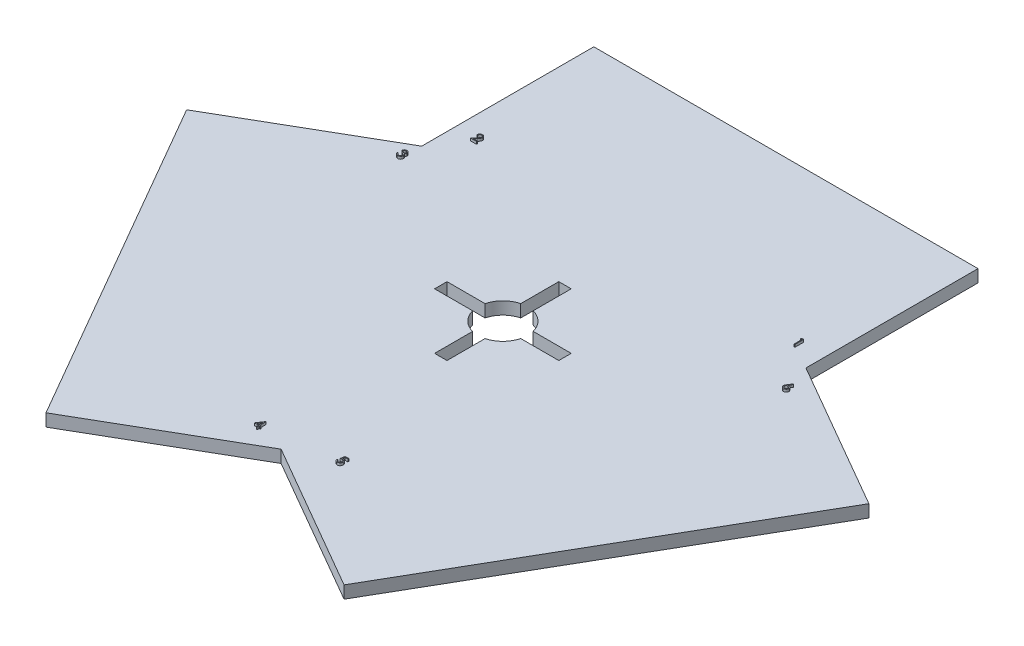
from build123d import *

# Parameters (mm, degrees)
BOSS_EXTRUDE1_DEPTH = 5
BOSS_EXTRUDE2_DEPTH = 1


with BuildPart() as part:
    # Sketch1 → Boss-Extrude1 (new body)
    with BuildSketch(Plane(origin=(0, 0, 0), x_dir=(1, 0, 0), z_dir=(0, 1, 0))):
        Polygon((-77.327282718, 44.644927493), (-77.327282718, 113.91847338), (77.327282718, 113.91847338), (77.327282718, 44.644927493), (137.319933266, 10.008154549), (59.992650548, -123.926627929), (0, -89.289854985), (-59.992650548, -123.926627929), (-137.319933266, 10.008154549), align=None)
        with BuildLine():
            ThreePointArc((9.682458366, 2.5), (7.071067812, 7.071067812), (2.5, 9.682458366))
            Line((2.5, 9.682458366), (2.5, 25))
            Line((2.5, 25), (-2.5, 25))
            Line((-2.5, 25), (-2.5, 9.682458366))
            ThreePointArc((-2.5, 9.682458366), (-7.071067812, 7.071067812), (-9.682458366, 2.5))
            Line((-9.682458366, 2.5), (-25, 2.5))
            Line((-25, 2.5), (-25, -2.5))
            Line((-25, -2.5), (-9.682458366, -2.5))
            ThreePointArc((-9.682458366, -2.5), (-7.071067812, -7.071067812), (-2.5, -9.682458366))
            Line((-2.5, -9.682458366), (-2.5, -25))
            Line((-2.5, -25), (2.5, -25))
            Line((2.5, -25), (2.5, -9.682458366))
            ThreePointArc((2.5, -9.682458366), (7.071067812, -7.071067812), (9.682458366, -2.5))
            Line((9.682458366, -2.5), (25, -2.5))
            Line((25, -2.5), (25, 2.5))
            Line((25, 2.5), (9.682458366, 2.5))
        make_face(mode=Mode.SUBTRACT)
    extrude(amount=BOSS_EXTRUDE1_DEPTH)

    # Sketch2 → Boss-Extrude2 (add)
    # profile 1 of 6: a face of its own
    with BuildSketch(Plane(origin=(0, 5, 0), x_dir=(1, 0, 0), z_dir=(0, 1, 0))):
        Polygon((67.265718779, 53.176435359), (67.912854195, 53.176435359), (67.912854195, 49.676435359), (67.598751631, 49.676435359), (67.598751631, 52.817461), (67.060290093, 52.817461), align=None)
    # profile 2 of 6: a face of its own
    with BuildSketch(Plane(origin=(0, 5, 0), x_dir=(1, 0, 0), z_dir=(0, 1, 0))):
        with BuildLine():
            Line((-68.907626042, 58.727715821), (-69.221728606, 58.727715821))
            add(Edge.make_bspline(
                [(-69.221728606, 58.727715821), (-69.219681453, 58.769386709), (-69.215660899, 58.851227223), (-69.19683261, 58.97055113), (-69.169891733, 59.084605928), (-69.131800279, 59.192475842), (-69.084494001, 59.29511465), (-69.027763974, 59.392114665), (-68.960570123, 59.483105854), (-68.884363389, 59.567244697), (-68.80159475, 59.644432268), (-68.712288811, 59.711087511), (-68.618443783, 59.767405182), (-68.520344384, 59.814486424), (-68.416883821, 59.84982627), (-68.309000963, 59.87604791), (-68.196221826, 59.891824255), (-68.119381804, 59.893520041), (-68.080302324, 59.894382488)],
                knots=[0, 0, 0, 0, 1.10065271, 2.161652631, 3.183658789, 4.190468796, 5.17591951, 6.163126047, 7.15150782, 8.156236427, 9.156009102, 10.134482811, 11.092018607, 12.041330605, 13.001268258, 13.972401359, 14.968799086, 16, 16, 16, 16], degree=3))
            add(Edge.make_bspline(
                [(-68.080302324, 59.894382488), (-68.04192425, 59.893484031), (-67.966512705, 59.891718596), (-67.856450691, 59.876557567), (-67.751673397, 59.852811975), (-67.65238563, 59.819496559), (-67.559379565, 59.774712132), (-67.471956521, 59.720914593), (-67.38907571, 59.658694762), (-67.314468926, 59.585440948), (-67.245960847, 59.507238564), (-67.186858592, 59.42375066), (-67.136245429, 59.337521374), (-67.094057749, 59.247893173), (-67.06300161, 59.154022144), (-67.039423402, 59.057274942), (-67.026095988, 58.956650131), (-67.024050565, 58.888543575), (-67.023010658, 58.853917744)],
                knots=[0, 0, 0, 0, 1.111607364, 2.184268762, 3.212621178, 4.221274766, 5.211760367, 6.196651075, 7.1921475, 8.207485113, 9.220403448, 10.201281604, 11.166441695, 12.114753415, 13.065576456, 14.026450734, 14.996634279, 16, 16, 16, 16], degree=3))
            add(Edge.make_bspline(
                [(-67.023010658, 58.853917744), (-67.02470392, 58.805169909), (-67.028060732, 58.708529696), (-67.056775108, 58.566514833), (-67.101621619, 58.428921414), (-67.155618976, 58.318184112), (-67.21009142, 58.228950618), (-67.259178928, 58.155481913), (-67.316643739, 58.076376445), (-67.383322237, 57.991899107), (-67.457835109, 57.901388202), (-67.540857272, 57.804898407), (-67.632980754, 57.703426637), (-67.697639255, 57.634121036), (-67.73114367, 57.598208609)],
                knots=[0, 0, 0, 0, 1.184426356, 2.348067706, 3.509069118, 4.696110526, 5.333549288, 6.050745305, 6.844228056, 7.710549037, 8.667450064, 9.695053472, 10.805634456, 12, 12, 12, 12], degree=3))
            Line((-67.73114367, 57.598208609), (-68.606844792, 56.663613257))
            Line((-68.606844792, 56.663613257), (-66.978138863, 56.663613257))
            Line((-66.978138863, 56.663613257), (-66.978138863, 56.304638898))
            Line((-66.978138863, 56.304638898), (-69.356343991, 56.304638898))
            Line((-69.356343991, 56.304638898), (-67.998972196, 57.753156526))
            add(Edge.make_bspline(
                [(-67.998972196, 57.753156526), (-67.965924309, 57.787654833), (-67.902446082, 57.853919019), (-67.812663505, 57.950661979), (-67.732024517, 58.04041152), (-67.660007124, 58.122998069), (-67.598173619, 58.199629636), (-67.543301387, 58.26782434), (-67.499335796, 58.33057879), (-67.4516204, 58.403319404), (-67.405406419, 58.492131721), (-67.365694063, 58.600665411), (-67.341479214, 58.712392663), (-67.338574379, 58.7878947), (-67.337113222, 58.825872872)],
                knots=[0, 0, 0, 0, 1.329631726, 2.553950428, 3.673215718, 4.687767853, 5.603093632, 6.413772471, 7.123043292, 7.734684054, 8.834405432, 9.900288307, 10.943827018, 12, 12, 12, 12], degree=3))
            add(Edge.make_bspline(
                [(-67.337113222, 58.825872872), (-67.337748964, 58.849754271), (-67.33900189, 58.896819921), (-67.350059587, 58.96582568), (-67.366770094, 59.032390494), (-67.390715352, 59.096719113), (-67.422322092, 59.158164765), (-67.460795472, 59.216802245), (-67.505185535, 59.27349121), (-67.556536804, 59.326644509), (-67.612948324, 59.375325714), (-67.672542574, 59.418449799), (-67.735592678, 59.45448891), (-67.8018328, 59.484032407), (-67.87107827, 59.507207789), (-67.943463015, 59.523266368), (-68.018787031, 59.533348852), (-68.070220527, 59.534713024), (-68.096428125, 59.535408129)],
                knots=[0, 0, 0, 0, 0.991446411, 1.95395049, 2.89581595, 3.838931463, 4.798493298, 5.75982156, 6.748411868, 7.785213223, 8.824556874, 9.840280684, 10.836137867, 11.835679398, 12.848801643, 13.863922112, 14.911575587, 16, 16, 16, 16], degree=3))
            add(Edge.make_bspline(
                [(-68.096428125, 59.535408129), (-68.123798958, 59.534693096), (-68.177550754, 59.533288891), (-68.256469787, 59.523466227), (-68.331755565, 59.506520387), (-68.403597468, 59.483343712), (-68.472117054, 59.453885163), (-68.536981098, 59.417193419), (-68.598043987, 59.373409926), (-68.65542051, 59.323769369), (-68.708284489, 59.268501768), (-68.754731365, 59.206891805), (-68.795315379, 59.14006439), (-68.830724613, 59.068199839), (-68.859480303, 58.990646059), (-68.881453453, 58.907678354), (-68.8988403, 58.819656973), (-68.904648821, 58.758871888), (-68.907626042, 58.727715821)],
                knots=[0, 0, 0, 0, 1.031018746, 2.02475058, 2.990194455, 3.934040569, 4.864654155, 5.795059489, 6.735614925, 7.690564532, 8.649604399, 9.611025574, 10.590972636, 11.591080095, 12.624614302, 13.701020113, 14.821632451, 16, 16, 16, 16], degree=3))
        make_face()
    # profile 3 of 6: a face of its own
    with BuildSketch(Plane(origin=(0, 5, 0), x_dir=(1, 0, 0), z_dir=(0, 1, 0))):
        with BuildLine():
            Line((-78.573756203, 38.283810532), (-78.887858767, 38.283810532))
            add(Edge.make_bspline(
                [(-78.887858767, 38.283810532), (-78.879349216, 38.319043015), (-78.862713741, 38.38791964), (-78.828016167, 38.486326901), (-78.790216912, 38.579450422), (-78.744827808, 38.665546496), (-78.695319053, 38.746345399), (-78.638596332, 38.820014523), (-78.577276609, 38.888427488), (-78.50945166, 38.949140726), (-78.438322998, 39.004118455), (-78.362888378, 39.050993513), (-78.284665485, 39.091317665), (-78.203112352, 39.124537897), (-78.11798618, 39.149563421), (-78.030056557, 39.167720227), (-77.939093057, 39.179511341), (-77.877345466, 39.180662104), (-77.84599178, 39.181246429)],
                knots=[0, 0, 0, 0, 1.162005537, 2.271625781, 3.343758855, 4.383309926, 5.390229558, 6.379919256, 7.361854164, 8.333198761, 9.295911338, 10.242430842, 11.177959212, 12.116337295, 13.062827104, 14.020064771, 14.994644689, 16, 16, 16, 16], degree=3))
            add(Edge.make_bspline(
                [(-77.84599178, 39.181246429), (-77.800309038, 39.179867199), (-77.709940027, 39.177138823), (-77.57717698, 39.152224387), (-77.449150161, 39.112799254), (-77.327260913, 39.058325527), (-77.21404248, 38.991138214), (-77.113306294, 38.911173477), (-77.026417783, 38.819974176), (-76.953523405, 38.719241611), (-76.896448406, 38.611586102), (-76.854362033, 38.500785945), (-76.828740352, 38.387103973), (-76.825419795, 38.310346694), (-76.823756203, 38.271891461)],
                knots=[0, 0, 0, 0, 1.083050992, 2.142477498, 3.193116406, 4.255571735, 5.30263384, 6.308962982, 7.297363603, 8.282367274, 9.249857812, 10.179914175, 11.08814088, 12, 12, 12, 12], degree=3))
            add(Edge.make_bspline(
                [(-76.823756203, 38.271891461), (-76.824919794, 38.234884666), (-76.827196761, 38.162468112), (-76.846530467, 38.056746615), (-76.879066729, 37.957105014), (-76.924136492, 37.863123852), (-76.982478042, 37.775399012), (-77.053150739, 37.693733122), (-77.136653401, 37.617763963), (-77.199932339, 37.57424449), (-77.232510209, 37.551839378)],
                knots=[0, 0, 0, 0, 1.024540389, 2.004866551, 2.965041327, 3.920577974, 4.882998113, 5.874504559, 6.905732034, 8, 8, 8, 8], degree=3))
            add(Edge.make_bspline(
                [(-77.232510209, 37.551839378), (-77.195278455, 37.533861206), (-77.12151158, 37.498241249), (-77.020961051, 37.428385491), (-76.929683176, 37.347729144), (-76.878779457, 37.284786491), (-76.853203318, 37.253161493)],
                knots=[0, 0, 0, 0, 1.015518401, 2.012035669, 3.001164323, 4, 4, 4, 4], degree=3))
            add(Edge.make_bspline(
                [(-76.853203318, 37.253161493), (-76.836361976, 37.230103741), (-76.80295508, 37.184365825), (-76.761719546, 37.110829399), (-76.724310432, 37.03647791), (-76.695160212, 36.959318504), (-76.672586346, 36.88024549), (-76.656450313, 36.799123094), (-76.646426173, 36.715885071), (-76.64499062, 36.659572591), (-76.644269023, 36.631266461)],
                knots=[0, 0, 0, 0, 1.025084078, 2.033381695, 3.024893161, 4.013698104, 4.991890475, 5.976764909, 6.982997093, 8, 8, 8, 8], degree=3))
            add(Edge.make_bspline(
                [(-76.644269023, 36.631266461), (-76.646063537, 36.58225674), (-76.649644119, 36.484467938), (-76.681648193, 36.339993216), (-76.731261434, 36.198767714), (-76.80171837, 36.063692875), (-76.887585879, 35.937312494), (-76.989743203, 35.824236185), (-77.107029611, 35.72703758), (-77.23783526, 35.645827352), (-77.379552389, 35.58090943), (-77.531127981, 35.535851987), (-77.690378035, 35.506505988), (-77.799585332, 35.503359119), (-77.855106363, 35.501759249)],
                knots=[0, 0, 0, 0, 0.955779014, 1.907060117, 2.875433937, 3.871313158, 4.872415639, 5.851225146, 6.836215519, 7.83643374, 8.849228613, 9.86973379, 10.916971861, 12, 12, 12, 12], degree=3))
            add(Edge.make_bspline(
                [(-77.855106363, 35.501759249), (-77.892525663, 35.502627463), (-77.966154368, 35.504335817), (-78.074397867, 35.516014418), (-78.177719566, 35.537344423), (-78.276259164, 35.566047729), (-78.3701042, 35.602439471), (-78.458968306, 35.647758169), (-78.543398199, 35.701069671), (-78.62259715, 35.763003259), (-78.696555718, 35.832284598), (-78.763308442, 35.910143608), (-78.823968235, 35.995141012), (-78.876910874, 36.088264068), (-78.924547827, 36.188309326), (-78.963728783, 36.296557824), (-78.998214352, 36.412041846), (-79.014247816, 36.492519586), (-79.022474152, 36.533810532)],
                knots=[0, 0, 0, 0, 1.048658725, 2.063410685, 3.046034179, 4.001477787, 4.936774919, 5.862367409, 6.792675028, 7.730719943, 8.675894397, 9.627829632, 10.600096036, 11.597688215, 12.626045268, 13.701542398, 14.82072376, 16, 16, 16, 16], degree=3))
            Line((-79.022474152, 36.533810532), (-78.708371587, 36.533810532))
            add(Edge.make_bspline(
                [(-78.708371587, 36.533810532), (-78.700188296, 36.506861518), (-78.684271083, 36.454443347), (-78.657176785, 36.379003041), (-78.626308513, 36.309844988), (-78.593193955, 36.246461866), (-78.558415509, 36.188229463), (-78.519500583, 36.136687594), (-78.479331438, 36.089572392), (-78.449052085, 36.06302778), (-78.434232966, 36.050036493)],
                knots=[0, 0, 0, 0, 1.198163088, 2.33053128, 3.407730985, 4.417276592, 5.372219308, 6.28897303, 7.162600585, 8, 8, 8, 8], degree=3))
            add(Edge.make_bspline(
                [(-78.434232966, 36.050036493), (-78.414636389, 36.034928159), (-78.375503726, 36.004758127), (-78.311735495, 35.966256499), (-78.244670609, 35.932895473), (-78.172855935, 35.907411778), (-78.097841164, 35.885834117), (-78.018413799, 35.871713598), (-77.935274582, 35.862025427), (-77.878506819, 35.861170495), (-77.849497389, 35.860733608)],
                knots=[0, 0, 0, 0, 0.946170439, 1.889420265, 2.845303464, 3.807233317, 4.801018734, 5.828864929, 6.890507805, 8, 8, 8, 8], degree=3))
            add(Edge.make_bspline(
                [(-77.849497389, 35.860733608), (-77.816743886, 35.861349514), (-77.752697239, 35.862553863), (-77.65924238, 35.87362957), (-77.570334932, 35.889759984), (-77.486962007, 35.914672966), (-77.408031499, 35.945453818), (-77.33464985, 35.984102223), (-77.265853743, 36.029446945), (-77.202524338, 36.080986103), (-77.14557883, 36.137407599), (-77.095439317, 36.19642067), (-77.052814656, 36.257776499), (-77.018431078, 36.32181462), (-76.991280527, 36.388269849), (-76.972797327, 36.457328678), (-76.959945812, 36.528425945), (-76.958899199, 36.576754913), (-76.958371587, 36.601118224)],
                knots=[0, 0, 0, 0, 1.217147791, 2.380027433, 3.494444702, 4.572153297, 5.609568379, 6.639424714, 7.649109417, 8.668170816, 9.669597737, 10.625200337, 11.543417969, 12.441394052, 13.322311151, 14.205496177, 15.095365482, 16, 16, 16, 16], degree=3))
            add(Edge.make_bspline(
                [(-76.958371587, 36.601118224), (-76.959901889, 36.633729563), (-76.962954878, 36.698789971), (-76.986263457, 36.794507545), (-77.024602321, 36.886730958), (-77.078274832, 36.973886748), (-77.143610561, 37.054662649), (-77.219975468, 37.126734132), (-77.308003696, 37.186204223), (-77.389023565, 37.227292879), (-77.460788722, 37.255329954), (-77.522204106, 37.274004919), (-77.59096071, 37.289818575), (-77.666227059, 37.304530846), (-77.748570275, 37.317052194), (-77.837900713, 37.32749401), (-77.934236475, 37.335849051), (-78.00092764, 37.339580146), (-78.035294664, 37.341502839)],
                knots=[0, 0, 0, 0, 1.07054697, 2.135767047, 3.216561865, 4.33974944, 5.486079747, 6.621378074, 7.775625952, 8.963672916, 9.598146892, 10.304877434, 11.070270905, 11.915000392, 12.823868403, 13.805723172, 14.86925407, 16, 16, 16, 16], degree=3))
            Line((-78.035294664, 37.341502839), (-78.035294664, 37.700477198))
            add(Edge.make_bspline(
                [(-78.035294664, 37.700477198), (-77.991993499, 37.701212002), (-77.907177152, 37.702651302), (-77.783282847, 37.720059312), (-77.664809535, 37.74413994), (-77.554382793, 37.781025133), (-77.45373408, 37.823865429), (-77.366414478, 37.873717639), (-77.293647331, 37.929132388), (-77.235786259, 37.990964998), (-77.19225703, 38.057280045), (-77.160430233, 38.126396703), (-77.141629907, 38.198920764), (-77.13912024, 38.248415432), (-77.137858767, 38.273293705)],
                knots=[0, 0, 0, 0, 1.321986639, 2.589447074, 3.816329219, 5.01088745, 6.139805852, 7.153945165, 8.075214402, 8.924034688, 9.728124013, 10.488707548, 11.240355623, 12, 12, 12, 12], degree=3))
            add(Edge.make_bspline(
                [(-77.137858767, 38.273293705), (-77.138273178, 38.29157145), (-77.139097629, 38.327934157), (-77.149494907, 38.381059226), (-77.165118948, 38.432560171), (-77.186598677, 38.482217982), (-77.215348876, 38.529688256), (-77.249754862, 38.575375705), (-77.290722962, 38.619019484), (-77.337668409, 38.659699803), (-77.388080214, 38.69846904), (-77.44332999, 38.731382677), (-77.501751864, 38.759527739), (-77.563410519, 38.782737241), (-77.628506049, 38.80019653), (-77.696732607, 38.812732371), (-77.768220291, 38.820570026), (-77.816992023, 38.821698442), (-77.841785049, 38.82227207)],
                knots=[0, 0, 0, 0, 0.884392785, 1.759457502, 2.611959086, 3.489218968, 4.37281399, 5.2945488, 6.255912374, 7.266815255, 8.301784654, 9.332968512, 10.37626691, 11.440494194, 12.520033166, 13.637162961, 14.798855837, 16, 16, 16, 16], degree=3))
            add(Edge.make_bspline(
                [(-77.841785049, 38.82227207), (-77.881636717, 38.820880708), (-77.959476293, 38.818163054), (-78.07169121, 38.794360041), (-78.176010544, 38.756381957), (-78.255749211, 38.711048938), (-78.314631785, 38.666298504), (-78.356708723, 38.627216118), (-78.398029234, 38.583783294), (-78.435874911, 38.533324919), (-78.474148887, 38.479258129), (-78.508993449, 38.418834447), (-78.542853141, 38.353630053), (-78.563255691, 38.307534418), (-78.573756203, 38.283810532)],
                knots=[0, 0, 0, 0, 1.472543308, 2.876219568, 4.221790263, 5.565193594, 6.249813518, 6.953379497, 7.687249741, 8.463570142, 9.283606569, 10.136032583, 11.040678096, 12, 12, 12, 12], degree=3))
        make_face()
    # profile 4 of 6: a face of its own
    with BuildSketch(Plane(origin=(0, 5, 0), x_dir=(1, 0, 0), z_dir=(0, 1, 0))):
        Polygon((-11.658407315, -83.716694186), (-11.594605232, -83.716694186), (-11.594605232, -86.139771109), (-11.190759078, -86.139771109), (-11.190759078, -86.498745468), (-11.594605232, -86.498745468), (-11.594605232, -87.306437776), (-11.908707796, -87.306437776), (-11.908707796, -86.498745468), (-13.568964206, -86.498745468), align=None)
        Polygon((-11.908707796, -86.139771109), (-11.908707796, -84.619739058), (-12.951977027, -86.139771109), align=None, mode=Mode.SUBTRACT)
    # profile 5 of 6: a face of its own
    with BuildSketch(Plane(origin=(0, 5, 0), x_dir=(1, 0, 0), z_dir=(0, 1, 0))):
        with BuildLine():
            Line((17.904319372, -79.939985711), (17.904319372, -80.29896007))
            Line((17.904319372, -80.29896007), (16.713814565, -80.29896007))
            Line((16.713814565, -80.29896007), (16.525212802, -81.219532987))
            add(Edge.make_bspline(
                [(16.525212802, -81.219532987), (16.562268676, -81.209302715), (16.634058572, -81.189483182), (16.740018433, -81.167477411), (16.840610636, -81.154211967), (16.905886007, -81.152400657), (16.937472417, -81.151524173)],
                knots=[0, 0, 0, 0, 1.100273476, 2.13160584, 3.095893838, 4, 4, 4, 4], degree=3))
            add(Edge.make_bspline(
                [(16.937472417, -81.151524173), (16.976556157, -81.152370109), (17.053404554, -81.15403343), (17.165843501, -81.170005279), (17.273176394, -81.195145194), (17.375178765, -81.230265715), (17.472039315, -81.275175449), (17.562866877, -81.331275389), (17.64902479, -81.39680872), (17.728967384, -81.472153732), (17.801491692, -81.555075349), (17.865257681, -81.64423322), (17.919420272, -81.738760882), (17.962981027, -81.839561491), (17.997765361, -81.945520644), (18.020917356, -82.057753227), (18.036334065, -82.175201347), (18.038056451, -82.255505917), (18.038934757, -82.296456064)],
                knots=[0, 0, 0, 0, 1.052922333, 2.070308379, 3.05430497, 4.020497103, 4.973039431, 5.925935799, 6.892292201, 7.88610001, 8.88166317, 9.857072816, 10.836096531, 11.812156883, 12.81219415, 13.836441305, 14.89672472, 16, 16, 16, 16], degree=3))
            add(Edge.make_bspline(
                [(18.038934757, -82.296456064), (18.038269682, -82.324978284), (18.036948519, -82.381637272), (18.030229931, -82.465781473), (18.017294215, -82.548144306), (17.999926491, -82.628736698), (17.977384073, -82.70740607), (17.950095019, -82.784377598), (17.916698992, -82.859172204), (17.880067616, -82.932497599), (17.838821138, -83.002696107), (17.793042631, -83.068345093), (17.74467714, -83.130429375), (17.692635754, -83.188283108), (17.636434759, -83.241526126), (17.576754792, -83.290474407), (17.514072073, -83.335955737), (17.447416831, -83.376123933), (17.378274348, -83.413086889), (17.305646131, -83.443410426), (17.231185431, -83.470520954), (17.153820555, -83.492130482), (17.073726742, -83.509063036), (16.990771967, -83.520563637), (16.905391297, -83.528940074), (16.847516284, -83.529464431), (16.818281712, -83.529729301)],
                knots=[0, 0, 0, 0, 1.056347294, 2.098418968, 3.122841568, 4.141288669, 5.149314143, 6.15115421, 7.162517403, 8.180376062, 9.185164535, 10.17417709, 11.141909838, 12.097768115, 13.052685741, 14.0056014, 14.954263652, 15.917497458, 16.885230207, 17.854509472, 18.828990115, 19.81800267, 20.826176721, 21.857883937, 22.917946725, 24, 24, 24, 24], degree=3))
            add(Edge.make_bspline(
                [(16.818281712, -83.529729301), (16.783407531, -83.529038463), (16.714796701, -83.527679321), (16.614276134, -83.513460836), (16.517561528, -83.493096919), (16.425431427, -83.46246065), (16.337060163, -83.424073355), (16.253637445, -83.375557183), (16.173031669, -83.32057808), (16.098519632, -83.255697727), (16.029363519, -83.184782045), (15.96745701, -83.107824404), (15.912323433, -83.026094961), (15.864845686, -82.939196807), (15.824347665, -82.847358276), (15.792532677, -82.750235276), (15.766854322, -82.648335272), (15.755990901, -82.578181761), (15.750473218, -82.542549814)],
                knots=[0, 0, 0, 0, 1.0467383, 2.05933395, 3.04377827, 4.011590433, 4.970194871, 5.932262533, 6.905835911, 7.896367577, 8.894135286, 9.877477877, 10.858688626, 11.851381753, 12.8477658, 13.868841284, 14.917554742, 16, 16, 16, 16], degree=3))
            Line((15.750473218, -82.542549814), (16.064575782, -82.542549814))
            add(Edge.make_bspline(
                [(16.064575782, -82.542549814), (16.07230434, -82.575926266), (16.087159056, -82.640077661), (16.119764805, -82.730209003), (16.159630681, -82.810528226), (16.207035029, -82.88209781), (16.263585059, -82.944506807), (16.328114488, -83.000123869), (16.400462212, -83.050298998), (16.480855441, -83.092121765), (16.56566852, -83.127790519), (16.65443573, -83.151542214), (16.744740077, -83.168243107), (16.805818447, -83.169914867), (16.836510879, -83.170754942)],
                knots=[0, 0, 0, 0, 1.136247022, 2.183929868, 3.172523383, 4.106158343, 5.02341133, 5.958108904, 6.928429099, 7.938127109, 8.96079061, 9.975095812, 10.982467395, 12, 12, 12, 12], degree=3))
            add(Edge.make_bspline(
                [(16.836510879, -83.170754942), (16.866469323, -83.169934164), (16.925457745, -83.168318046), (17.012269132, -83.155879034), (17.096082006, -83.136721463), (17.176069363, -83.108051608), (17.253630902, -83.073206889), (17.326804673, -83.028491813), (17.39770755, -82.977031795), (17.464135684, -82.918075165), (17.524975133, -82.85310547), (17.578731254, -82.783628077), (17.623508167, -82.70951123), (17.661242276, -82.632038077), (17.689895575, -82.55035952), (17.710336556, -82.464858345), (17.722339615, -82.375323365), (17.723990795, -82.314254055), (17.724832193, -82.28313475)],
                knots=[0, 0, 0, 0, 1.027316725, 2.022795036, 3.002884548, 3.971462791, 4.93288096, 5.914575861, 6.907176829, 7.935150275, 8.956128384, 9.956726525, 10.942570165, 11.921478529, 12.907843606, 13.90538589, 14.932640048, 16, 16, 16, 16], degree=3))
            add(Edge.make_bspline(
                [(17.724832193, -82.28313475), (17.724173713, -82.255058998), (17.722884833, -82.200104709), (17.712354263, -82.119705503), (17.694037291, -82.043632461), (17.668613411, -81.971518227), (17.636333903, -81.903294784), (17.596887591, -81.838891724), (17.549534193, -81.779157891), (17.495442304, -81.724065337), (17.436184263, -81.673220462), (17.370740521, -81.629876376), (17.300480594, -81.593412458), (17.226250994, -81.56194446), (17.146286096, -81.539343714), (17.062169463, -81.522375829), (16.972992756, -81.512560466), (16.912022067, -81.511198578), (16.880681552, -81.510498532)],
                knots=[0, 0, 0, 0, 1.045622112, 2.046656509, 3.013763289, 3.955457236, 4.890082067, 5.820317437, 6.762574623, 7.722996705, 8.69280354, 9.665887285, 10.63943826, 11.638615906, 12.663482002, 13.728887084, 14.832589034, 16, 16, 16, 16], degree=3))
            add(Edge.make_bspline(
                [(16.880681552, -81.510498532), (16.853552623, -81.511079123), (16.797538268, -81.512277897), (16.711615441, -81.521104393), (16.621323718, -81.535343688), (16.527009222, -81.554929935), (16.428388714, -81.580561012), (16.325670314, -81.611275513), (16.218638047, -81.647997511), (16.146520323, -81.675729725), (16.109447577, -81.689985711)],
                knots=[0, 0, 0, 0, 0.817624296, 1.688186739, 2.600797293, 3.572016777, 4.590301741, 5.671205678, 6.80286297, 8, 8, 8, 8], degree=3))
            Line((16.109447577, -81.689985711), (16.468421936, -79.939985711))
            Line((16.468421936, -79.939985711), (17.904319372, -79.939985711))
        make_face()
    # profile 6 of 6: a face of its own
    with BuildSketch(Plane(origin=(0, 5, 0), x_dir=(1, 0, 0), z_dir=(0, 1, 0))):
        with BuildLine():
            Line((81.393620247, 35.590969512), (81.635507266, 35.400965506))
            Line((81.635507266, 35.400965506), (80.710727619, 33.986802845))
            add(Edge.make_bspline(
                [(80.710727619, 33.986802845), (80.772297896, 33.996616706), (80.892397683, 34.015759751), (81.013963581, 34.018917696), (81.073207587, 34.020456692)],
                knots=[0, 0, 0, 0, 1.025318673, 2, 2, 2, 2], degree=3))
            add(Edge.make_bspline(
                [(81.073207587, 34.020456692), (81.108780083, 34.01950058), (81.178803484, 34.017618502), (81.281610286, 34.003134652), (81.380399222, 33.98030954), (81.474760834, 33.947037284), (81.565033816, 33.90453493), (81.651736212, 33.853596059), (81.733238222, 33.791590379), (81.810589401, 33.722325423), (81.880816499, 33.645608439), (81.942992554, 33.564207102), (81.995219346, 33.478206221), (82.037593268, 33.387649355), (82.070498146, 33.292676095), (82.094485791, 33.193407956), (82.108665384, 33.089776484), (82.110590875, 33.019298309), (82.111568965, 32.983497557)],
                knots=[0, 0, 0, 0, 1.04369286, 2.054478336, 3.041073146, 4.015093852, 4.984733326, 5.965804835, 6.960378782, 7.985147595, 9.009457201, 10.008161701, 10.986880575, 11.956520048, 12.937015923, 13.931873656, 14.949455224, 16, 16, 16, 16], degree=3))
            add(Edge.make_bspline(
                [(82.111568965, 32.983497557), (82.11014586, 32.934517853), (82.107345527, 32.838137387), (82.079441731, 32.697760681), (82.036082086, 32.564028165), (81.974104557, 32.439074994), (81.897122174, 32.323072424), (81.803244582, 32.220286959), (81.695801093, 32.128616921), (81.574314295, 32.051960302), (81.443571331, 31.989357251), (81.306219334, 31.944392009), (81.163592187, 31.91670854), (81.066787579, 31.913237937), (81.017818965, 31.911482333)],
                knots=[0, 0, 0, 0, 1.031375318, 2.029502543, 3.004789286, 3.987476834, 4.960371455, 5.9300674, 6.912260825, 7.929083631, 8.949397511, 9.960523116, 10.96833055, 12, 12, 12, 12], degree=3))
            add(Edge.make_bspline(
                [(81.017818965, 31.911482333), (80.970722264, 31.913010538), (80.877431946, 31.916037646), (80.740199152, 31.943003584), (80.608336135, 31.986710687), (80.482766754, 32.046924966), (80.366446141, 32.122982849), (80.262380505, 32.214545128), (80.17108873, 32.319654593), (80.095114109, 32.43829494), (80.034855377, 32.565784897), (79.989665452, 32.698722054), (79.963269209, 32.836622036), (79.959580652, 32.930103175), (79.957722811, 32.977187461)],
                knots=[0, 0, 0, 0, 1.012016664, 2.004627821, 2.994792927, 3.992885782, 4.990978636, 5.973936114, 6.964471063, 7.975201453, 8.993600317, 9.990122807, 10.98767138, 12, 12, 12, 12], degree=3))
            add(Edge.make_bspline(
                [(79.957722811, 32.977187461), (79.958904256, 33.013232044), (79.961316541, 33.086828196), (79.978159932, 33.198292224), (80.005224726, 33.312343306), (80.035534973, 33.409097499), (80.067560583, 33.488359021), (80.094213122, 33.552262512), (80.127387118, 33.618023585), (80.1627605, 33.687897221), (80.203517368, 33.760082654), (80.247833018, 33.835786323), (80.296932669, 33.913804251), (80.331352832, 33.966748446), (80.348948773, 33.993814063)],
                knots=[0, 0, 0, 0, 1.173818275, 2.396712641, 3.66331629, 4.989737886, 5.693666774, 6.447286557, 7.243889047, 8.091586357, 8.998013824, 9.943181721, 10.948533338, 12, 12, 12, 12], degree=3))
            Line((80.348948773, 33.993814063), (81.393620247, 35.590969512))
        make_face()
        with BuildLine():
            add(Edge.make_bspline(
                [(81.007302138, 33.661482333), (80.980639893, 33.660704289), (80.928560784, 33.659184544), (80.852153369, 33.650359292), (80.779840118, 33.633740226), (80.710662984, 33.612573894), (80.645915281, 33.583470834), (80.585126441, 33.548119035), (80.528061389, 33.506497857), (80.475317838, 33.459196946), (80.427498174, 33.407408913), (80.386317044, 33.351939391), (80.350794644, 33.294125188), (80.321912825, 33.233483246), (80.299422749, 33.170036746), (80.283154498, 33.104077497), (80.274100747, 33.035163191), (80.272594515, 32.988430688), (80.271825375, 32.964567269)],
                knots=[0, 0, 0, 0, 1.129588631, 2.206414736, 3.251139165, 4.268635594, 5.265702196, 6.250456724, 7.242448911, 8.251968645, 9.246821453, 10.222880186, 11.173611482, 12.116736599, 13.062300278, 14.020270554, 14.989073742, 16, 16, 16, 16], degree=3))
            add(Edge.make_bspline(
                [(80.271825375, 32.964567269), (80.272451737, 32.940917289), (80.273679938, 32.894543199), (80.284832258, 32.826204019), (80.301867341, 32.760439111), (80.327207737, 32.697587512), (80.357434625, 32.636691194), (80.397339949, 32.579955909), (80.441556735, 32.523935839), (80.494410668, 32.472934367), (80.551134031, 32.425477743), (80.611735234, 32.383997489), (80.674895193, 32.348511316), (80.741466616, 32.320700218), (80.810505, 32.297875932), (80.882585554, 32.281814452), (80.957758409, 32.272733926), (81.008680347, 32.271225733), (81.034645888, 32.270456692)],
                knots=[0, 0, 0, 0, 0.989467248, 1.94019797, 2.891935182, 3.827694429, 4.772920941, 5.730924762, 6.725747692, 7.756678648, 8.79901574, 9.819492441, 10.826891316, 11.826466727, 12.835195252, 13.867842842, 14.912794438, 16, 16, 16, 16], degree=3))
            add(Edge.make_bspline(
                [(81.034645888, 32.270456692), (81.060611387, 32.271225793), (81.111533241, 32.272734105), (81.186706702, 32.281813774), (81.25878502, 32.297878422), (81.327831529, 32.320691192), (81.39437296, 32.348544801), (81.457477681, 32.383776721), (81.517505775, 32.425732839), (81.574266374, 32.472853267), (81.626900313, 32.524226119), (81.672177592, 32.579455842), (81.710860825, 32.637149737), (81.742295012, 32.697347627), (81.767356303, 32.760477114), (81.78447777, 32.826193838), (81.795607059, 32.894545864), (81.796838426, 32.940918189), (81.797466401, 32.964567269)],
                knots=[0, 0, 0, 0, 1.087397944, 2.132534446, 3.165364764, 4.174271784, 5.174024072, 6.181601208, 7.194203697, 8.236725232, 9.267838612, 10.269026844, 11.221737037, 12.171628256, 13.107553087, 14.05945871, 15.010357665, 16, 16, 16, 16], degree=3))
            add(Edge.make_bspline(
                [(81.797466401, 32.964567269), (81.796916108, 32.988461819), (81.795836062, 33.035359052), (81.783620113, 33.10404667), (81.766677739, 33.170371876), (81.741094709, 33.233917825), (81.707858164, 33.294433753), (81.667374757, 33.352225354), (81.620542187, 33.407735701), (81.566444647, 33.459298509), (81.507554413, 33.506445587), (81.444938828, 33.548065144), (81.379430854, 33.58319012), (81.311096912, 33.612497223), (81.239154029, 33.633646697), (81.16476369, 33.65029994), (81.086974447, 33.659161957), (81.034197839, 33.660699023), (81.007302138, 33.661482333)],
                knots=[0, 0, 0, 0, 0.978206639, 1.919901502, 2.851605144, 3.780102724, 4.718870031, 5.675451981, 6.667674623, 7.690630536, 8.733308323, 9.756129687, 10.767539656, 11.776269907, 12.797430371, 13.836405707, 14.897401972, 16, 16, 16, 16], degree=3))
        make_face(mode=Mode.SUBTRACT)
    extrude(amount=BOSS_EXTRUDE2_DEPTH)


solid = part.part
